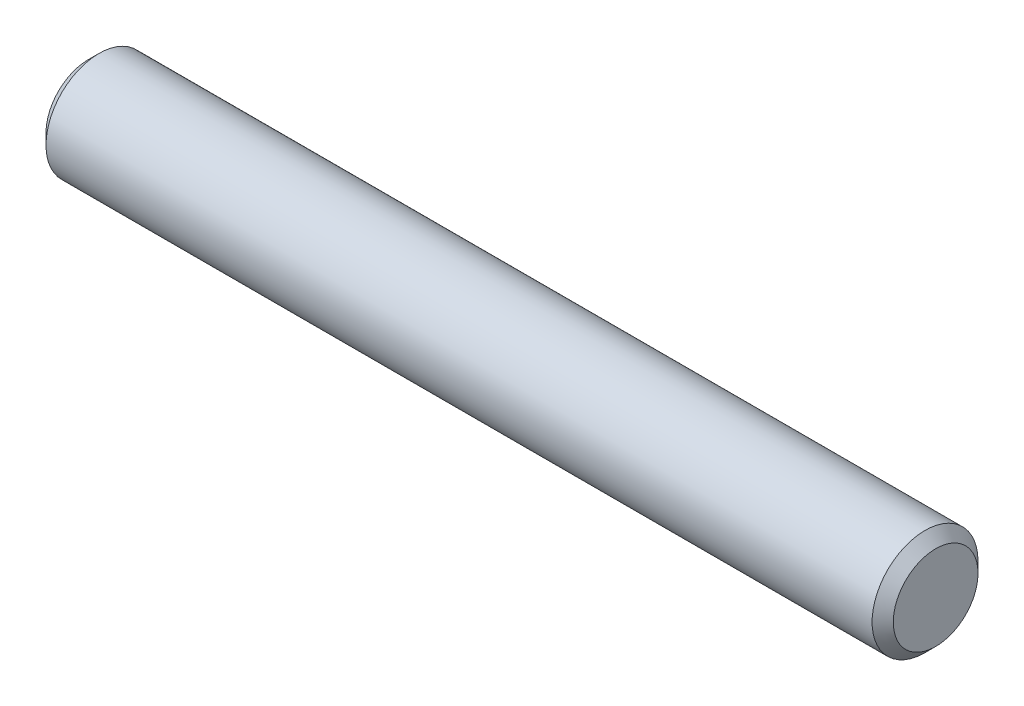
from build123d import *

# Parameters (mm, degrees)
EXTRUDE1_DEPTH      = 6.35
EXTRUDE1_DEPTH_BACK = 6.35
SKETCH2_R           = 0.79375
CHAMFER1_SIZE       = 0.15875


with BuildPart() as part:
    # Sketch2 → Extrude1 (new, two sides: drawn at the far end of the back side and taken through both)
    with BuildSketch(Plane(origin=(0, 0, 0), x_dir=(0, 0, -1), z_dir=(1, 0, 0)).offset(-EXTRUDE1_DEPTH_BACK)):
        Circle(SKETCH2_R)
    extrude(amount=EXTRUDE1_DEPTH + EXTRUDE1_DEPTH_BACK)

    # Chamfer1
    chamfer1_edges = [part.edges().sort_by_distance(p)[0] for p in [
        (-6.35, 0, 0.79375),
        (6.35, 0, 0.79375),
    ]]
    chamfer(chamfer1_edges, length=CHAMFER1_SIZE)


solid = part.part
